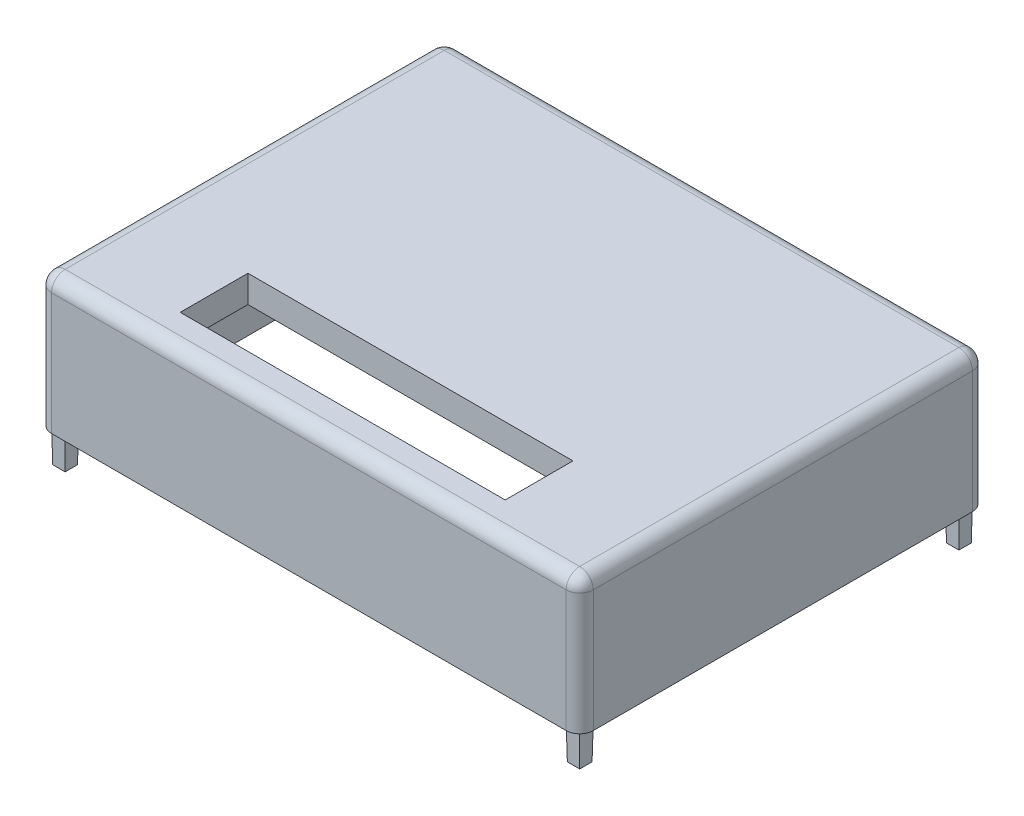
from build123d import *

# Parameters (mm, degrees)
SKETCH1_W               = 101.6
SKETCH1_H               = 76.2
BOSS_EXTRUDE1_DEPTH     = 25.4
SKETCH5_W               = 91.44
SKETCH5_H               = 71.12
CUT_EXTRUDE1_DEPTH      = 20.32
FILLET1_R               = 2.54
SKETCH7_W               = 2.54
SKETCH7_H               = 2.54
BOSS_EXTRUDE2_DEPTH     = 6.35
BOSS_EXTRUDE2_TAPER     = 1
MIRROR4_COPY_1_SKETCH_W = 2.54
MIRROR4_COPY_1_SKETCH_H = 2.54
MIRROR4_COPY_1_DEPTH    = 6.35
MIRROR4_COPY_1_TAPER    = 1
SKETCH8_W               = 60.96
SKETCH8_H               = 12.7
CUT_EXTRUDE2_DEPTH      = 71.99515833
SKETCH9_W               = 50.8
SKETCH9_H               = 20.32
BOSS_EXTRUDE3_DEPTH     = 2.54


with BuildPart() as part:
    # Sketch1 → Boss-Extrude1 (new body)
    with BuildSketch(Plane(origin=(0, 0, 0), x_dir=(1, 0, 0), z_dir=(0, 1, 0))):
        Rectangle(SKETCH1_W, SKETCH1_H)
    extrude(amount=BOSS_EXTRUDE1_DEPTH)

    # Sketch5 → Cut-Extrude1 (cut)
    with BuildSketch(Plane.XZ):
        Rectangle(SKETCH5_W, SKETCH5_H)
    extrude(amount=-CUT_EXTRUDE1_DEPTH, mode=Mode.SUBTRACT)

    # Fillet1
    fillet1_edges = [part.edges().sort_by_distance(p)[0] for p in [
        (-50.8, 25.4, 0),
        (0, 25.4, 38.1),
        (50.8, 25.4, 0),
        (50.8, 12.7, 38.1),
        (-50.8, 12.7, 38.1),
        (-50.8, 12.7, -38.1),
        (50.8, 12.7, -38.1),
        (0, 25.4, -38.1),
    ]]
    fillet(fillet1_edges, radius=FILLET1_R)

    # Sketch7 → Boss-Extrude2 (add)
    with BuildSketch(Plane(origin=(0, 0, 0), x_dir=(-1, 0, 0), z_dir=(0, -1, 0))):
        with Locations((48.26, -35.56)):
            Rectangle(SKETCH7_W, SKETCH7_H)
    boss_extrude2 = extrude(amount=BOSS_EXTRUDE2_DEPTH, taper=BOSS_EXTRUDE2_TAPER)

    # Mirror3: Boss-Extrude2 across plane
    add(boss_extrude2.mirror(Plane(origin=(0, 0, 0), x_dir=(0, 0, 1), z_dir=(1, 0, 0))))

    # Mirror4: Boss-Extrude2 across plane
    add(boss_extrude2.mirror(Plane.XY))

    # Mirror4 copy 1 sketch → Mirror4 copy 1 (add)
    with BuildSketch(Plane.XZ):
        with Locations((48.26, -35.56)):
            Rectangle(MIRROR4_COPY_1_SKETCH_W, MIRROR4_COPY_1_SKETCH_H)
    extrude(amount=MIRROR4_COPY_1_DEPTH, taper=MIRROR4_COPY_1_TAPER)

    # Sketch8 → Cut-Extrude2 (cut, through all)
    with BuildSketch(Plane(origin=(0, 25.4, 0), x_dir=(1, 0, 0), z_dir=(0, 1, 0))):
        with Locations((0, -25.4)):
            Rectangle(SKETCH8_W, SKETCH8_H)
    extrude(amount=-CUT_EXTRUDE2_DEPTH, mode=Mode.SUBTRACT)

    # Sketch9 → Boss-Extrude3 (add)
    with BuildSketch(Plane(origin=(0, 0, 35.56), x_dir=(-1, 0, 0), z_dir=(0, 0, -1))):
        with Locations((0, 10.16)):
            Rectangle(SKETCH9_W, SKETCH9_H)
    extrude(amount=BOSS_EXTRUDE3_DEPTH)


solid = part.part
